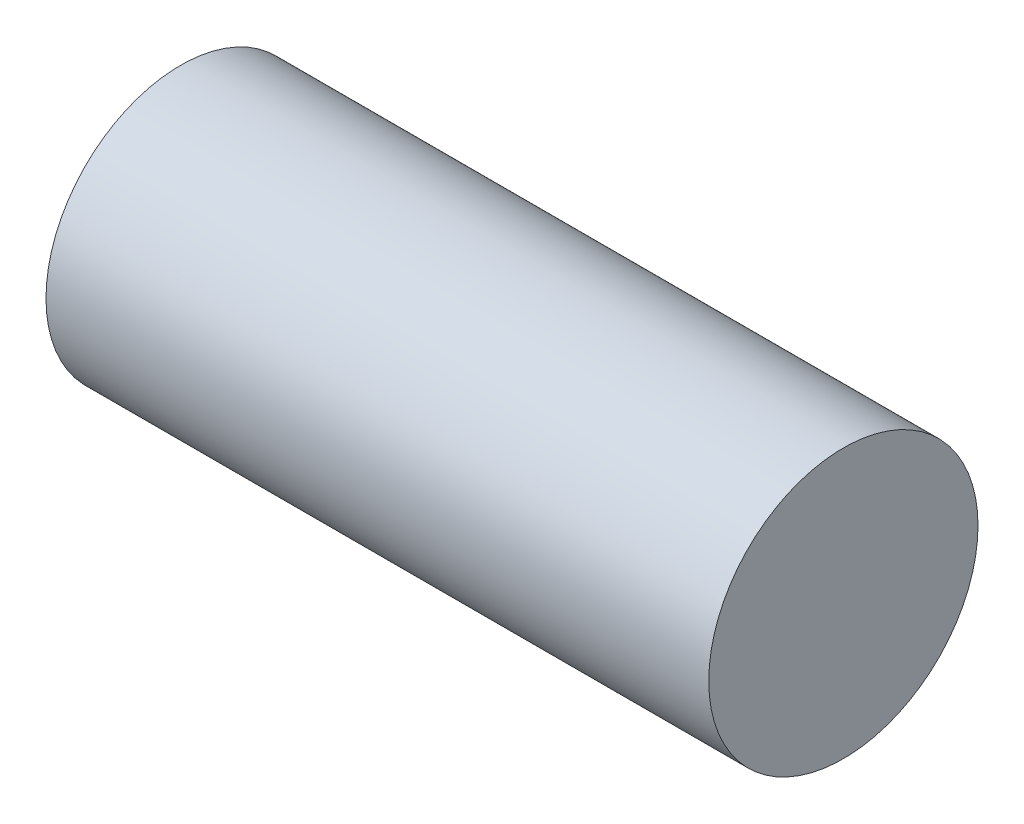
from build123d import *


with BuildPart() as part:
    # Sketch2 → Revolve1 (revolve)
    with BuildSketch(Plane.XY, mode=Mode.PRIVATE) as revolve1_sk:
        Polygon((0, 0.089566929), (0, 1.625), (8, 1.625), (8, 0), (0, 0), align=None)
    revolve(revolve1_sk.sketch.rotate(Axis((0, 1.625, 0), (1, 0, 0)), 270), axis=Axis((0, 1.625, 0), (1, 0, 0)))


solid = part.part
